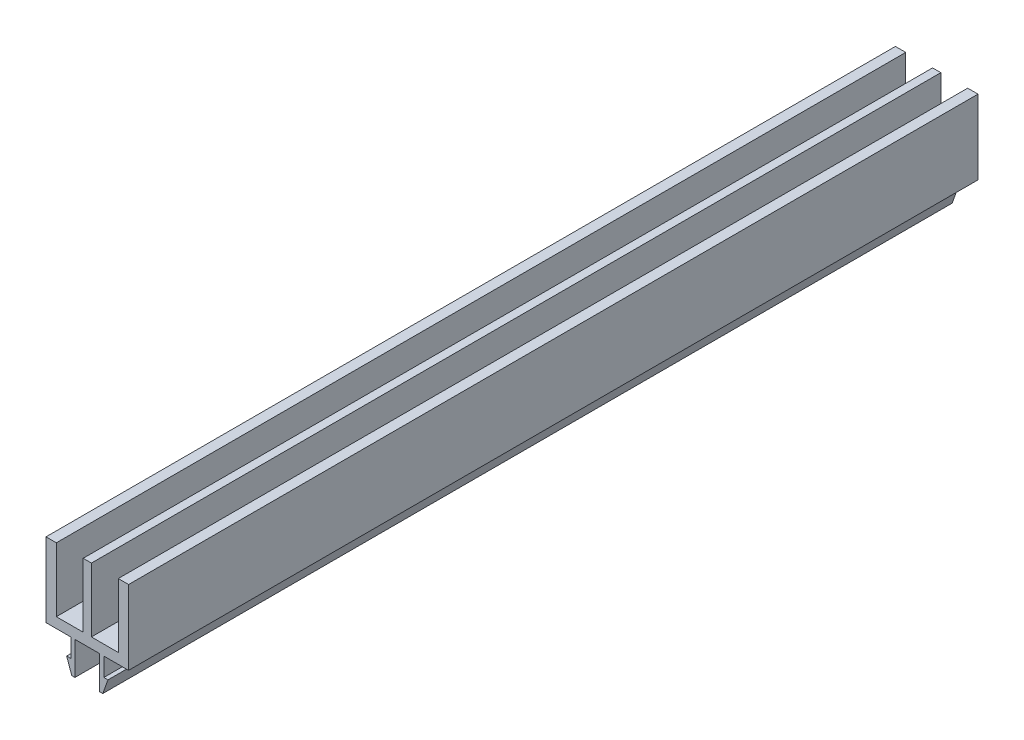
from build123d import *

# Parameters (mm, degrees)
BOSS_EXTRU_1_DEPTH = 205.71


with BuildPart() as part:
    # Esquisse1 → Boss.-Extru.1 (new body)
    with BuildSketch(Plane.XY.offset(50)):
        Polygon((-1, 2.5), (-7.5, 2.5), (-7.5, 17.999999998), (-10, 17.999999998), (-10, 0), (-4, 0), (-4, -4.5), (-5, -4.5), (-3.75, -8), (-3, -8), (-3, 0), (3, 0), (3, -8), (3.75, -8), (5, -4.5), (4, -4.5), (4, 0), (10, 0), (10, 17.999999998), (7.5, 17.999999998), (7.5, 2.5), (1, 2.5), (1, 17.999999998), (-1, 17.999999998), align=None)
    extrude(amount=-BOSS_EXTRU_1_DEPTH)


solid = part.part
